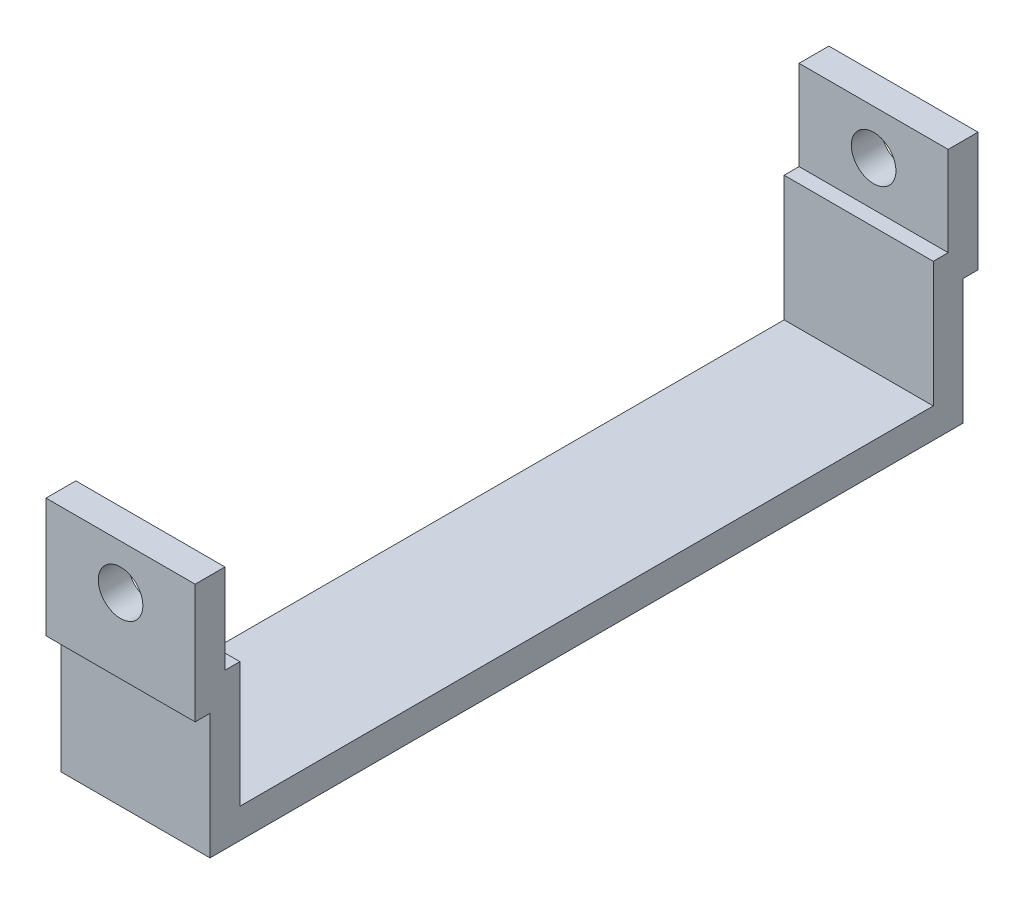
from build123d import *

# Parameters (mm, degrees)
EXTRUDE_THIN1_DEPTH       = 12.7
F_6_CLEARANCE_HOLE1_D     = 3.7973
F_6_CLEARANCE_HOLE1_DEPTH = 7.62
F_6_CLEARANCE_HOLE1_TIP   = 1.140824014
F_6_CLEARANCE_HOLE2_D     = 3.7973
F_6_CLEARANCE_HOLE2_DEPTH = 7.62
F_6_CLEARANCE_HOLE2_TIP   = 1.140824014


with BuildPart() as part:
    # Sketch1 → Extrude-Thin1 (new body)
    with BuildSketch(Plane(origin=(0, 0, 0), x_dir=(0, 0, -1), z_dir=(1, 0, 0))):
        Polygon((-1.27, 18.288), (-1.27, 10.668), (0, 10.668), (0, 0), (59.055, 0), (59.055, 10.668), (60.325, 10.668), (60.325, 18.288), (62.865, 18.288), (62.865, 8.128), (61.595, 8.128), (61.595, -2.54), (-2.54, -2.54), (-2.54, 8.128), (-3.81, 8.128), (-3.81, 18.288), align=None)
    extrude(amount=EXTRUDE_THIN1_DEPTH)

    # #6 Clearance Hole1
    with Locations(Plane(origin=(0, 0, 1.27), x_dir=(-1, 0, 0), z_dir=(0, 0, -1))):
        with Locations((-6.35, 14.478)):
            Hole(F_6_CLEARANCE_HOLE1_D / 2, depth=F_6_CLEARANCE_HOLE1_DEPTH)
            with Locations((0, 0, -(F_6_CLEARANCE_HOLE1_DEPTH + F_6_CLEARANCE_HOLE1_TIP / 2))):  # 118° drill point
                Cone(0, F_6_CLEARANCE_HOLE1_D / 2, F_6_CLEARANCE_HOLE1_TIP, mode=Mode.SUBTRACT)

    # #6 Clearance Hole2
    with Locations(Plane.XY.offset(-60.325)):
        with Locations((6.35, 14.478)):
            Hole(F_6_CLEARANCE_HOLE2_D / 2, depth=F_6_CLEARANCE_HOLE2_DEPTH)
            with Locations((0, 0, -(F_6_CLEARANCE_HOLE2_DEPTH + F_6_CLEARANCE_HOLE2_TIP / 2))):  # 118° drill point
                Cone(0, F_6_CLEARANCE_HOLE2_D / 2, F_6_CLEARANCE_HOLE2_TIP, mode=Mode.SUBTRACT)


solid = part.part
